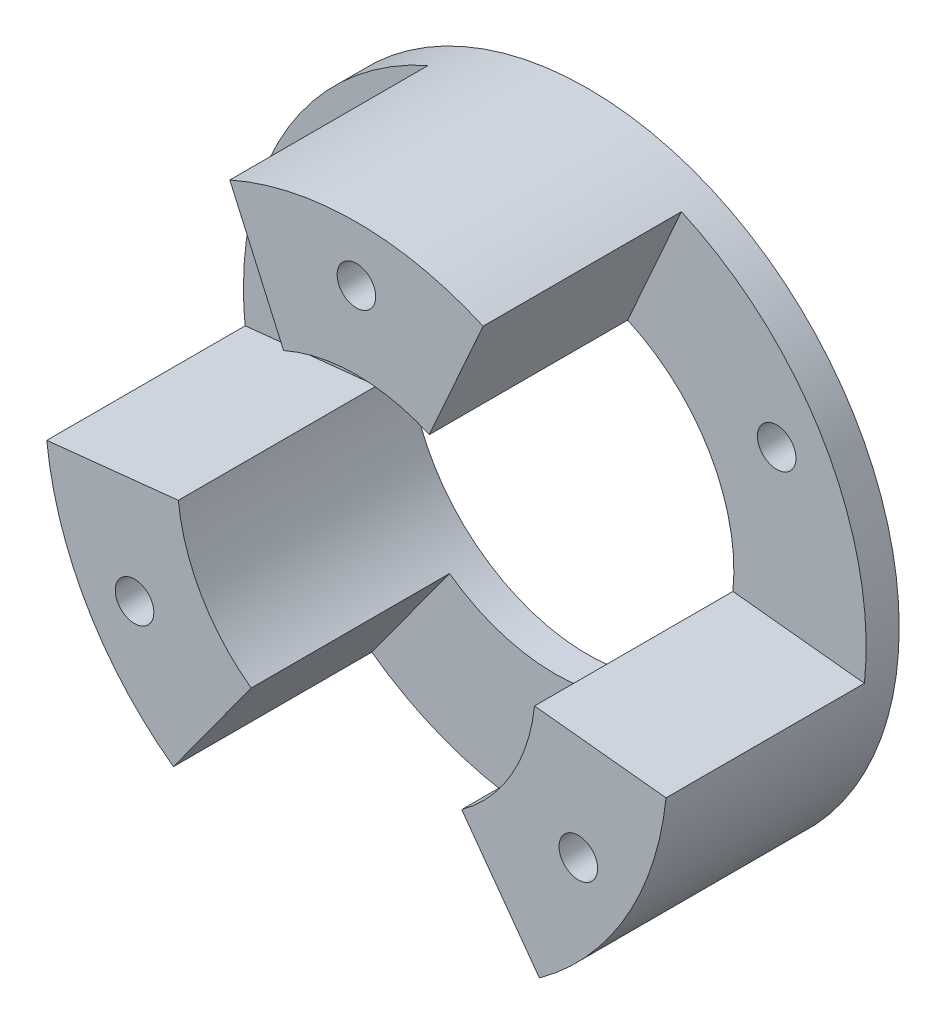
from build123d import *

# Parameters (mm, degrees)
SKETCH2_W           = 3
SKETCH2_H           = 12
BOSS_EXTRUDE1_DEPTH = 18
CIRPATTERN1_COUNT   = 3
SKETCH4_R           = 1.75
CUT_EXTRUDE1_DEPTH  = 12
CIRPATTERN2_COUNT   = 3
SKETCH5_R           = 1.75
CUT_EXTRUDE2_DEPTH  = 44.819230938
CIRPATTERN3_COUNT   = 3


with BuildPart() as part:
    # Sketch2 → Revolve1 (revolve)
    with BuildSketch(Plane(origin=(0, 0, 0), x_dir=(0, 0, -1), z_dir=(1, 0, 0)), mode=Mode.PRIVATE) as revolve1_sk:
        with Locations((-1.5, 22.25)):
            Rectangle(SKETCH2_W, SKETCH2_H)
    revolve(revolve1_sk.sketch.rotate(Axis((0, 0, 0), (0, 0, 1)), 90), axis=Axis((0, 0, 0), (0, 0, 1)))

    # Sketch3 → Boss-Extrude1 (add)
    with BuildSketch(Plane.XY.offset(3)):
        with BuildLine():
            Line((-6.60947045, 14.845113687), (-11.490310167, 25.807659178))
            ThreePointArc((-11.490310167, 25.807659178), (0, 28.25), (11.490310167, 25.807659178))
            Line((11.490310167, 25.807659178), (6.60947045, 14.845113687))
            ThreePointArc((6.60947045, 14.845113687), (0, 16.25), (-6.60947045, 14.845113687))
        make_face()
    boss_extrude1 = extrude(amount=BOSS_EXTRUDE1_DEPTH)

    # CirPattern1: Boss-Extrude1 ×3 about axis
    cirpattern1_axis = Axis((0, 0, 0), (0, 0, 1))
    for i in range(1, CIRPATTERN1_COUNT):
        add(boss_extrude1.rotate(cirpattern1_axis, i * 360 / CIRPATTERN1_COUNT))

    # Sketch4 → Cut-Extrude1 (cut)
    with BuildSketch(Plane.XY.offset(21)):
        with Locations((0, 23.25)):
            Circle(SKETCH4_R)
    cut_extrude1 = extrude(amount=-CUT_EXTRUDE1_DEPTH, mode=Mode.SUBTRACT)

    # CirPattern2: Cut-Extrude1 ×3 about axis
    cirpattern2_axis = Axis((0, 0, 0), (0, 0, 1))
    for i in range(1, CIRPATTERN2_COUNT):
        add(cut_extrude1.rotate(cirpattern2_axis, i * 360 / CIRPATTERN2_COUNT), mode=Mode.SUBTRACT)

    # Sketch5 → Cut-Extrude2 (cut, through all)
    with BuildSketch(Plane.XY.offset(3)):
        with Locations((0, -23.25)):
            Circle(SKETCH5_R)
    cut_extrude2 = extrude(amount=-CUT_EXTRUDE2_DEPTH, mode=Mode.SUBTRACT)

    # CirPattern3: Cut-Extrude2 ×3 about axis
    cirpattern3_axis = Axis((0, 0, 0), (0, 0, 1))
    for i in range(1, CIRPATTERN3_COUNT):
        add(cut_extrude2.rotate(cirpattern3_axis, i * 360 / CIRPATTERN3_COUNT), mode=Mode.SUBTRACT)


solid = part.part
